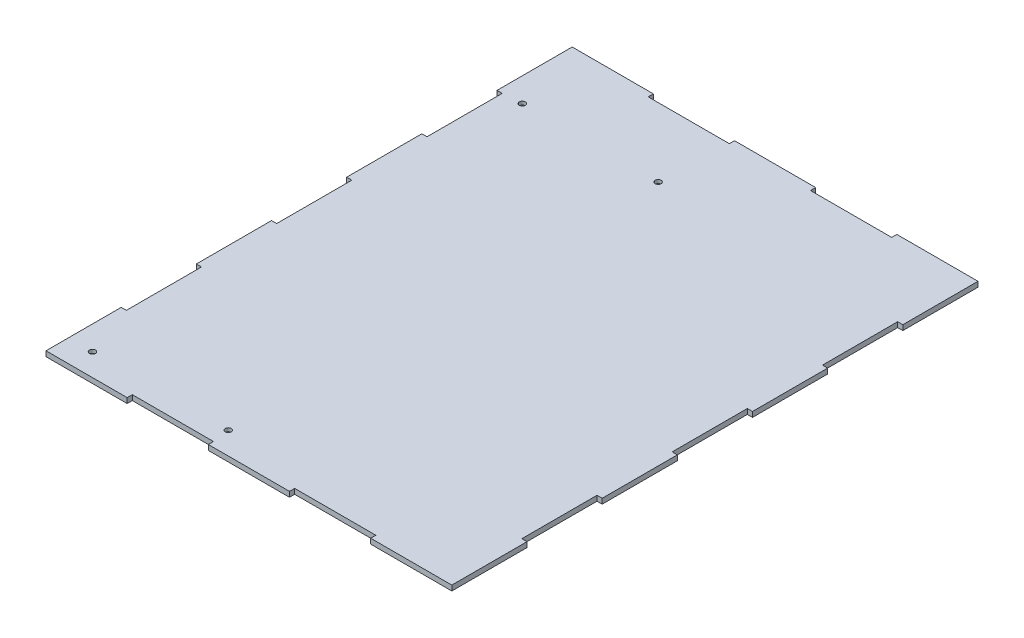
from build123d import *

# Parameters (mm, degrees)
BOSS_EXTRU_1_DEPTH                  = 3
DIAM_TRE_DU_PER_AGE_3_5_3_5_1_D     = 3.5
DIAM_TRE_DU_PER_AGE_3_5_3_5_1_DEPTH = 2
DIAM_TRE_DU_PER_AGE_3_5_3_5_1_TIP   = 1.051506083


with BuildPart() as part:
    # Esquisse1 → Boss.-Extru.1 (new body)
    with BuildSketch(Plane(origin=(0, 0, 0), x_dir=(1, 0, 0), z_dir=(0, 1, 0))):
        Polygon((-70.8, 150), (-23.6, 150), (-23.6, 153), (23.6, 153), (23.6, 150), (70.8, 150), (70.8, 153), (118, 153), (118, 109.285714286), (115, 109.285714286), (115, 65.571428571), (118, 65.571428571), (118, 21.857142857), (115, 21.857142857), (115, -21.857142857), (118, -21.857142857), (118, -65.571428571), (115, -65.571428571), (115, -109.285714286), (118, -109.285714286), (118, -153), (70.8, -153), (70.8, -150), (23.6, -150), (23.6, -153), (-23.6, -153), (-23.6, -150), (-70.8, -150), (-70.8, -153), (-118, -153), (-118, -109.285714286), (-115, -109.285714286), (-115, -65.571428571), (-118, -65.571428571), (-118, -21.857142857), (-115, -21.857142857), (-115, 21.857142857), (-118, 21.857142857), (-118, 65.571428571), (-115, 65.571428571), (-115, 109.285714286), (-118, 109.285714286), (-118, 153), (-70.8, 153), align=None)
    extrude(amount=BOSS_EXTRU_1_DEPTH)

    # Diamètre du perçage Ø3.5 (3.5)1
    with Locations(Plane(origin=(0, 3, 0), x_dir=(1, 0, 0), z_dir=(0, 1, 0))):
        with Locations((-104, -140), (-25, -140), (-104, 110), (-25, 110)):
            Hole(DIAM_TRE_DU_PER_AGE_3_5_3_5_1_D / 2, depth=DIAM_TRE_DU_PER_AGE_3_5_3_5_1_DEPTH)
            with Locations((0, 0, -(DIAM_TRE_DU_PER_AGE_3_5_3_5_1_DEPTH + DIAM_TRE_DU_PER_AGE_3_5_3_5_1_TIP / 2))):  # 118° drill point
                Cone(0, DIAM_TRE_DU_PER_AGE_3_5_3_5_1_D / 2, DIAM_TRE_DU_PER_AGE_3_5_3_5_1_TIP, mode=Mode.SUBTRACT)


solid = part.part
